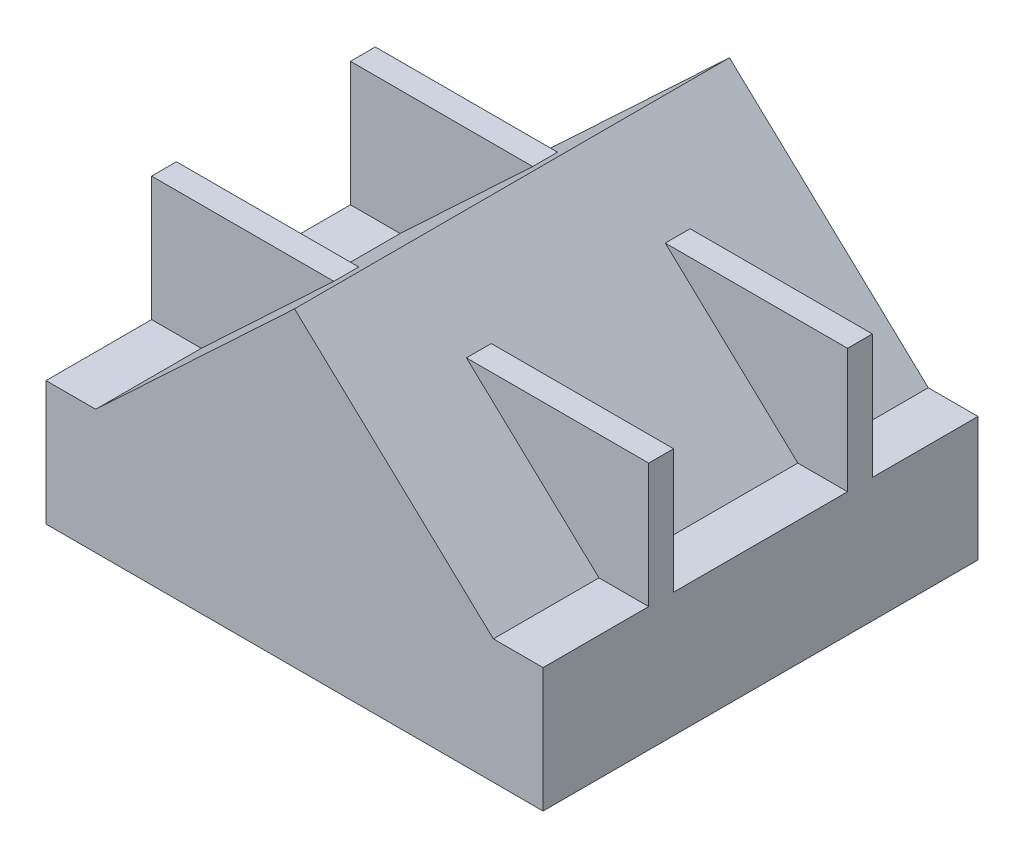
from build123d import *

# Parameters (mm, degrees)
SKETCH1_W           = 200
SKETCH1_H           = 175
BOSS_EXTRUDE1_DEPTH = 50
BOSS_EXTRUDE2_DEPTH = 175
SKETCH4_W           = 200
SKETCH4_H           = 10
BOSS_EXTRUDE3_DEPTH = 50
SKETCH6_W           = 200
SKETCH6_H           = 10
BOSS_EXTRUDE4_DEPTH = 50


with BuildPart() as part:
    # Sketch1 → Boss-Extrude1 (new body)
    with BuildSketch(Plane(origin=(0, 0, 0), x_dir=(1, 0, 0), z_dir=(0, 1, 0))):
        with Locations((0, 14.608639935)):
            Rectangle(SKETCH1_W, SKETCH1_H)
    extrude(amount=BOSS_EXTRUDE1_DEPTH)

    # Sketch3 → Boss-Extrude2 (add)
    with BuildSketch(Plane.XY.offset(72.891360065)):
        Polygon((-80, 50), (0, 125), (80, 50), align=None)
    extrude(amount=-BOSS_EXTRUDE2_DEPTH)

    # Sketch4 → Boss-Extrude3 (add)
    with BuildSketch(Plane(origin=(0, 50, 0), x_dir=(1, 0, 0), z_dir=(0, 1, 0))):
        with Locations((0, 54.608639935)):
            Rectangle(SKETCH4_W, SKETCH4_H)
    extrude(amount=BOSS_EXTRUDE3_DEPTH)

    # Sketch6 → Boss-Extrude4 (add)
    with BuildSketch(Plane(origin=(0, 50, 0), x_dir=(1, 0, 0), z_dir=(0, 1, 0))):
        with Locations((0, -25.391360065)):
            Rectangle(SKETCH6_W, SKETCH6_H)
    extrude(amount=BOSS_EXTRUDE4_DEPTH)


solid = part.part
